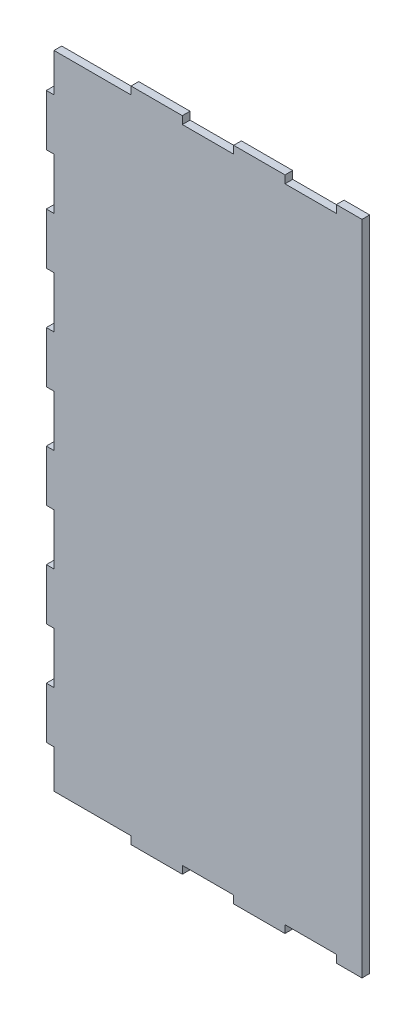
from build123d import *

# Parameters (mm, degrees)
BOSS_EXTRUDE1_DEPTH = 3


with BuildPart() as part:
    # Sketch2 → Boss-Extrude1 (new body)
    with BuildSketch(Plane.XY):
        Polygon((-2.957577841, 75.05923357), (0.042422159, 75.05923357), (0.042422159, 95.05923357), (-2.957577841, 95.05923357), (-2.957577841, 115.05923357), (0.042422159, 115.05923357), (0.042422159, 135.05923357), (-2.957577841, 135.05923357), (-2.957577841, 155.05923357), (0.042422159, 155.05923357), (0.042422159, 175.05923357), (-2.957577841, 175.05923357), (-2.957577841, 195.05923357), (0.042422159, 195.05923357), (0.042422159, 215.05923357), (-2.957577841, 215.05923357), (-2.957577841, 235.05923357), (0.042422159, 235.05923357), (0.042422159, 250.05923357), (30.042422159, 250.05923357), (30.042422159, 253.05923357), (50.042422159, 253.05923357), (50.042422159, 250.05923357), (70.042422159, 250.05923357), (70.042422159, 253.05923357), (90.042422159, 253.05923357), (90.042422159, 250.05923357), (110.042422159, 250.05923357), (110.042422159, 253.05923357), (120.042422159, 253.05923357), (120.042422159, -2.94076643), (110.042422159, -2.94076643), (110.042422159, 0.05923357), (90.042422159, 0.05923357), (90.042422159, -2.94076643), (70.042422159, -2.94076643), (70.042422159, 0.05923357), (50.042422159, 0.05923357), (50.042422159, -2.94076643), (30.042422159, -2.94076643), (30.042422159, 0.05923357), (0.042422159, 0.05923357), (0.042422159, 15.05923357), (-2.957577841, 15.05923357), (-2.957577841, 35.05923357), (0.042422159, 35.05923357), (0.042422159, 55.05923357), (-2.957577841, 55.05923357), align=None)
    extrude(amount=BOSS_EXTRUDE1_DEPTH)


solid = part.part
